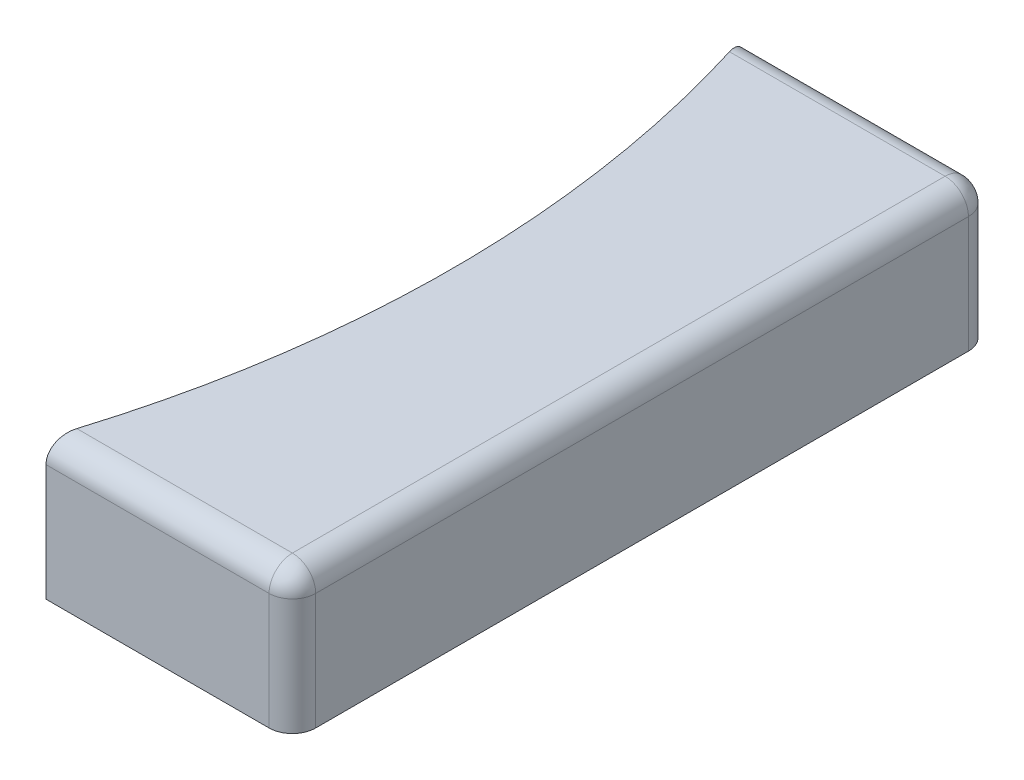
from build123d import *

# Parameters (mm, degrees)
BOSS_EXTRUDE1_DEPTH = 6
SHELL1_T            = -1
FILLET1_R           = 1


with BuildPart() as part:
    # Sketch1 → Boss-Extrude1 (new body)
    with BuildSketch(Plane(origin=(0, 0, 0), x_dir=(1, 0, 0), z_dir=(0, 1, 0))):
        with BuildLine():
            Line((0, 0), (10.57, 0))
            Line((10.57, 0), (10.57, -30))
            Line((10.57, -30), (0, -30))
            ThreePointArc((0, -30), (2.434164903, -15), (0, 0))
        make_face()
    extrude(amount=BOSS_EXTRUDE1_DEPTH)

    # Shell1
    shell1_openings = [part.faces().sort_by_distance(p)[0] for p in [
        (6.071410828, 0, 15),
        (2.434164903, 3, 15),
    ]]
    offset(amount=SHELL1_T, openings=shell1_openings, kind=Kind.INTERSECTION)

    # Fillet1
    fillet1_edges = [part.edges().sort_by_distance(p)[0] for p in [
        (10.57, 6, 15),
        (5.285, 6, 0),
        (10.57, 3, 0),
        (10.57, 3, 30),
        (5.285, 6, 30),
    ]]
    fillet(fillet1_edges, radius=FILLET1_R)


solid = part.part
